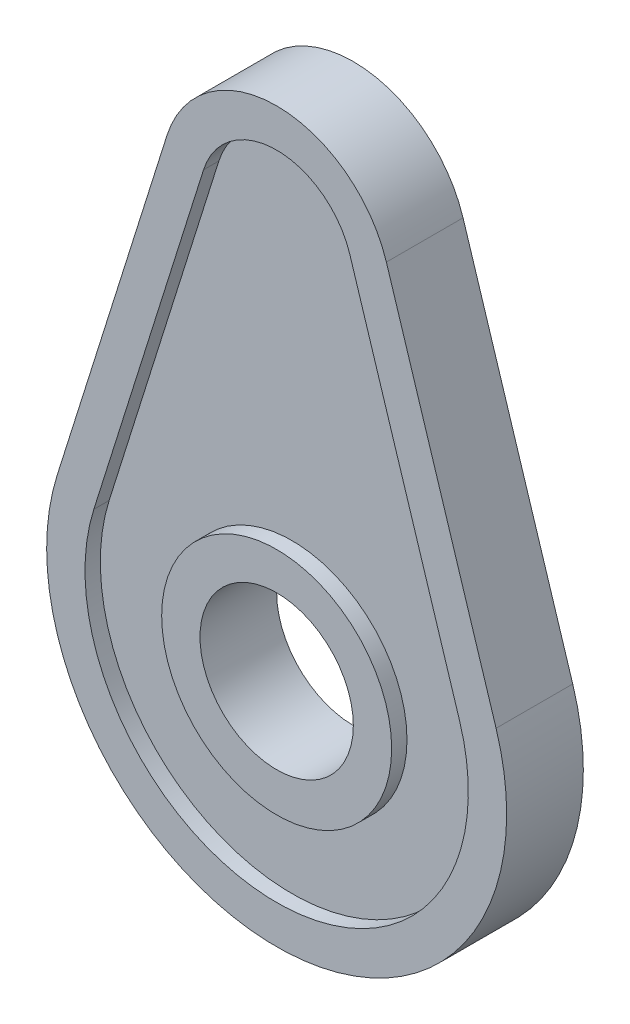
from build123d import *

# Parameters (mm, degrees)
BOSS_EXTRUDE1_DEPTH = 10
CUT_EXTRUDE1_DEPTH  = 2
CUT_EXTRUDE3_START  = -2
CUT_EXTRUDE3_DEPTH  = 2
SKETCH6_R           = 15
BOSS_EXTRUDE2_DEPTH = 2
SKETCH7_R           = 10
CUT_EXTRUDE4_DEPTH  = 73.284161474
SKETCH8_R           = 15
SKETCH8_R_2         = 10
BOSS_EXTRUDE3_DEPTH = 2


with BuildPart() as part:
    # Sketch2 → Boss-Extrude1 (new body)
    with BuildSketch(Plane.XY):
        with BuildLine():
            Line((-14.309088021, 54.5), (-28.618176043, 9))
            ThreePointArc((-28.618176043, 9), (0, -30), (28.618176043, 9))
            Line((28.618176043, 9), (14.309088021, 54.5))
            ThreePointArc((14.309088021, 54.5), (0, 65), (-14.309088021, 54.5))
        make_face()
    extrude(amount=BOSS_EXTRUDE1_DEPTH)

    # Sketch3 → Cut-Extrude1 (cut)
    with BuildSketch(Plane.XY.offset(10)):
        with BuildLine():
            Line((-9.539392014, 53), (-23.848480035, 7.5))
            ThreePointArc((-23.848480035, 7.5), (0, -25), (23.848480035, 7.5))
            Line((23.848480035, 7.5), (9.539392014, 53))
            ThreePointArc((9.539392014, 53), (0, 60), (-9.539392014, 53))
        make_face()
    extrude(amount=-CUT_EXTRUDE1_DEPTH, mode=Mode.SUBTRACT)

    # Sketch5 → Cut-Extrude3 (cut)
    with BuildSketch(Plane(origin=(0, 0, 0), x_dir=(-1, 0, 0), z_dir=(0, 0, -1)).offset(CUT_EXTRUDE3_START)):
        with BuildLine():
            Line((-9.539392014, 53), (-23.848480035, 7.5))
            ThreePointArc((-23.848480035, 7.5), (0, -25), (23.848480035, 7.5))
            Line((23.848480035, 7.5), (9.539392014, 53))
            ThreePointArc((9.539392014, 53), (0, 60), (-9.539392014, 53))
        make_face()
    extrude(amount=CUT_EXTRUDE3_DEPTH, mode=Mode.SUBTRACT)

    # Sketch6 → Boss-Extrude2 (add)
    with BuildSketch(Plane.XY.offset(8)):
        with Locations((0, -0.109030318)):
            Circle(SKETCH6_R)
    extrude(amount=BOSS_EXTRUDE2_DEPTH)

    # Sketch7 → Cut-Extrude4 (cut, through all)
    with BuildSketch(Plane.XY.offset(10)):
        Circle(SKETCH7_R)
    extrude(amount=-CUT_EXTRUDE4_DEPTH, mode=Mode.SUBTRACT)

    # Sketch8 → Boss-Extrude3 (add)
    with BuildSketch(Plane(origin=(0, 0, 2), x_dir=(-1, 0, 0), z_dir=(0, 0, -1))):
        Circle(SKETCH8_R)
        with Locations(Location((0, 0, 0), (0, 0, 180))):
            Circle(SKETCH8_R_2, mode=Mode.SUBTRACT)
    extrude(amount=BOSS_EXTRUDE3_DEPTH)


solid = part.part
